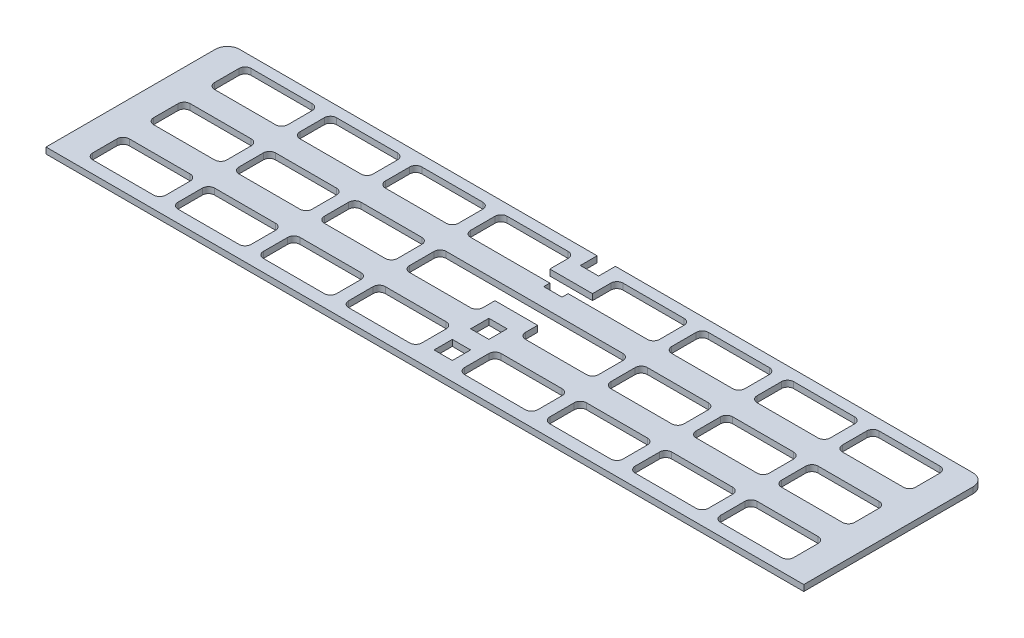
from build123d import *

# Parameters (mm, degrees)
BOSS_EXTRUDE1_DEPTH = 6.35
CUT_EXTRUDE1_DEPTH  = 6.35
SKETCH3_W           = 19.05
SKETCH3_H           = 19.05
BOSS_EXTRUDE2_DEPTH = 6.35
CUT_EXTRUDE2_DEPTH  = 447.276861552


with BuildPart() as part:
    # Sketch1 → Boss-Extrude1 (new body)
    with BuildSketch(Plane(origin=(0, 0, 0), x_dir=(1, 0, 0), z_dir=(0, 1, 0))):
        with BuildLine():
            Line((0, 0), (385.191, 0))
            Line((385.191, 0), (385.191, 176.276))
            ThreePointArc((385.191, 176.276), (381.471256121, 185.256256121), (372.491, 188.976))
            Line((372.491, 188.976), (0, 188.976))
            Line((0, 188.976), (0, 0))
        make_face()
    boss_extrude1 = extrude(amount=BOSS_EXTRUDE1_DEPTH)

    # Sketch2 → Cut-Extrude1 (cut)
    with BuildSketch(Plane(origin=(0, 6.35, 0), x_dir=(1, 0, 0), z_dir=(0, 1, 0))):
        with BuildLine():
            Line((279.4, 19.05), (279.4, 44.45))
            ThreePointArc((279.4, 44.45), (281.259871939, 48.940128061), (285.75, 50.8))
            Line((285.75, 50.8), (349.25, 50.8))
            ThreePointArc((349.25, 50.8), (353.740128061, 48.940128061), (355.6, 44.45))
            Line((355.6, 44.45), (355.6, 19.05))
            ThreePointArc((355.6, 19.05), (353.740128061, 14.559871939), (349.25, 12.7))
            Line((349.25, 12.7), (285.75, 12.7))
            ThreePointArc((285.75, 12.7), (281.259871939, 14.559871939), (279.4, 19.05))
        make_face()
        with BuildLine():
            Line((279.4, 82.55), (279.4, 107.95))
            ThreePointArc((279.4, 107.95), (281.259871939, 112.440128061), (285.75, 114.3))
            Line((285.75, 114.3), (349.25, 114.3))
            ThreePointArc((349.25, 114.3), (353.740128061, 112.440128061), (355.6, 107.95))
            Line((355.6, 107.95), (355.6, 82.55))
            ThreePointArc((355.6, 82.55), (353.740128061, 78.059871939), (349.25, 76.2))
            Line((349.25, 76.2), (285.75, 76.2))
            ThreePointArc((285.75, 76.2), (281.259871939, 78.059871939), (279.4, 82.55))
        make_face()
        with BuildLine():
            Line((101.6, 19.05), (101.6, 44.45))
            ThreePointArc((101.6, 44.45), (103.459871939, 48.940128061), (107.95, 50.8))
            Line((107.95, 50.8), (171.45, 50.8))
            ThreePointArc((171.45, 50.8), (175.940128061, 48.940128061), (177.8, 44.45))
            Line((177.8, 44.45), (177.8, 19.05))
            ThreePointArc((177.8, 19.05), (175.940128061, 14.559871939), (171.45, 12.7))
            Line((171.45, 12.7), (107.95, 12.7))
            ThreePointArc((107.95, 12.7), (103.459871939, 14.559871939), (101.6, 19.05))
        make_face()
        with BuildLine():
            Line((279.4, 146.05), (279.4, 171.45))
            ThreePointArc((279.4, 171.45), (281.259871939, 175.940128061), (285.75, 177.8))
            Line((285.75, 177.8), (349.25, 177.8))
            ThreePointArc((349.25, 177.8), (353.740128061, 175.940128061), (355.6, 171.45))
            Line((355.6, 171.45), (355.6, 146.05))
            ThreePointArc((355.6, 146.05), (353.740128061, 141.559871939), (349.25, 139.7))
            Line((349.25, 139.7), (285.75, 139.7))
            ThreePointArc((285.75, 139.7), (281.259871939, 141.559871939), (279.4, 146.05))
        make_face()
        with BuildLine():
            Line((19.05, 12.7), (82.55, 12.7))
            ThreePointArc((82.55, 12.7), (87.040128061, 14.559871939), (88.9, 19.05))
            Line((88.9, 19.05), (88.9, 44.45))
            ThreePointArc((88.9, 44.45), (87.040128061, 48.940128061), (82.55, 50.8))
            Line((82.55, 50.8), (19.05, 50.8))
            ThreePointArc((19.05, 50.8), (14.559871939, 48.940128061), (12.7, 44.45))
            Line((12.7, 44.45), (12.7, 19.05))
            ThreePointArc((12.7, 19.05), (14.559871939, 14.559871939), (19.05, 12.7))
        make_face()
        with BuildLine():
            Line((190.5, 19.05), (190.5, 44.45))
            ThreePointArc((190.5, 44.45), (192.359871939, 48.940128061), (196.85, 50.8))
            Line((196.85, 50.8), (260.35, 50.8))
            ThreePointArc((260.35, 50.8), (264.840128061, 48.940128061), (266.7, 44.45))
            Line((266.7, 44.45), (266.7, 19.05))
            ThreePointArc((266.7, 19.05), (264.840128061, 14.559871939), (260.35, 12.7))
            Line((260.35, 12.7), (196.85, 12.7))
            ThreePointArc((196.85, 12.7), (192.359871939, 14.559871939), (190.5, 19.05))
        make_face()
        with BuildLine():
            Line((101.6, 82.55), (101.6, 107.95))
            ThreePointArc((101.6, 107.95), (103.459871939, 112.440128061), (107.95, 114.3))
            Line((107.95, 114.3), (171.45, 114.3))
            ThreePointArc((171.45, 114.3), (175.940128061, 112.440128061), (177.8, 107.95))
            Line((177.8, 107.95), (177.8, 82.55))
            ThreePointArc((177.8, 82.55), (175.940128061, 78.059871939), (171.45, 76.2))
            Line((171.45, 76.2), (107.95, 76.2))
            ThreePointArc((107.95, 76.2), (103.459871939, 78.059871939), (101.6, 82.55))
        make_face()
        with BuildLine():
            Line((190.5, 82.55), (190.5, 107.95))
            ThreePointArc((190.5, 107.95), (192.359871939, 112.440128061), (196.85, 114.3))
            Line((196.85, 114.3), (260.35, 114.3))
            ThreePointArc((260.35, 114.3), (264.840128061, 112.440128061), (266.7, 107.95))
            Line((266.7, 107.95), (266.7, 82.55))
            ThreePointArc((266.7, 82.55), (264.840128061, 78.059871939), (260.35, 76.2))
            Line((260.35, 76.2), (196.85, 76.2))
            ThreePointArc((196.85, 76.2), (192.359871939, 78.059871939), (190.5, 82.55))
        make_face()
        with BuildLine():
            Line((101.6, 146.05), (101.6, 171.45))
            ThreePointArc((101.6, 171.45), (103.459871939, 175.940128061), (107.95, 177.8))
            Line((107.95, 177.8), (171.45, 177.8))
            ThreePointArc((171.45, 177.8), (175.940128061, 175.940128061), (177.8, 171.45))
            Line((177.8, 171.45), (177.8, 146.05))
            ThreePointArc((177.8, 146.05), (175.940128061, 141.559871939), (171.45, 139.7))
            Line((171.45, 139.7), (107.95, 139.7))
            ThreePointArc((107.95, 139.7), (103.459871939, 141.559871939), (101.6, 146.05))
        make_face()
        with BuildLine():
            Line((190.5, 146.05), (190.5, 171.45))
            ThreePointArc((190.5, 171.45), (192.359871939, 175.940128061), (196.85, 177.8))
            Line((196.85, 177.8), (260.35, 177.8))
            ThreePointArc((260.35, 177.8), (264.840128061, 175.940128061), (266.7, 171.45))
            Line((266.7, 171.45), (266.7, 146.05))
            ThreePointArc((266.7, 146.05), (264.840128061, 141.559871939), (260.35, 139.7))
            Line((260.35, 139.7), (196.85, 139.7))
            ThreePointArc((196.85, 139.7), (192.359871939, 141.559871939), (190.5, 146.05))
        make_face()
        with BuildLine():
            Line((12.7, 82.55), (12.7, 107.95))
            ThreePointArc((12.7, 107.95), (14.559871939, 112.440128061), (19.05, 114.3))
            Line((19.05, 114.3), (82.55, 114.3))
            ThreePointArc((82.55, 114.3), (87.040128061, 112.440128061), (88.9, 107.95))
            Line((88.9, 107.95), (88.9, 82.55))
            ThreePointArc((88.9, 82.55), (87.040128061, 78.059871939), (82.55, 76.2))
            Line((82.55, 76.2), (19.05, 76.2))
            ThreePointArc((19.05, 76.2), (14.559871939, 78.059871939), (12.7, 82.55))
        make_face()
        with BuildLine():
            Line((12.7, 146.05), (12.7, 171.45))
            ThreePointArc((12.7, 171.45), (14.559871939, 175.940128061), (19.05, 177.8))
            Line((19.05, 177.8), (82.55, 177.8))
            ThreePointArc((82.55, 177.8), (87.040128061, 175.940128061), (88.9, 171.45))
            Line((88.9, 171.45), (88.9, 146.05))
            ThreePointArc((88.9, 146.05), (87.040128061, 141.559871939), (82.55, 139.7))
            Line((82.55, 139.7), (19.05, 139.7))
            ThreePointArc((19.05, 139.7), (14.559871939, 141.559871939), (12.7, 146.05))
        make_face()
    cut_extrude1 = extrude(amount=-CUT_EXTRUDE1_DEPTH, mode=Mode.SUBTRACT)

    # Sketch3 → Boss-Extrude2 (add)
    with BuildSketch(Plane(origin=(0, 6.35, 0), x_dir=(1, 0, 0), z_dir=(0, 1, 0))):
        with Locations((-9.525, 9.525)):
            Rectangle(SKETCH3_W, SKETCH3_H)
        with Locations((-9.525, 47.625)):
            Rectangle(SKETCH3_W, SKETCH3_H)
        with Locations((-9.525, 85.725)):
            Rectangle(SKETCH3_W, SKETCH3_H)
        with Locations((-9.525, 123.825)):
            Rectangle(SKETCH3_W, SKETCH3_H)
        with Locations((-9.525, 161.925)):
            Rectangle(SKETCH3_W, SKETCH3_H)
    extrude(amount=-BOSS_EXTRUDE2_DEPTH)

    # Mirror3: Boss-Extrude1 across plane
    add(boss_extrude1.mirror(Plane.ZY.offset(9.525)))

    # Mirror2: Cut-Extrude1 across plane
    add(cut_extrude1.mirror(Plane.ZY.offset(9.525)), mode=Mode.SUBTRACT)

    # Sketch4 → Cut-Extrude2 (cut, through all)
    with BuildSketch(Plane(origin=(0, 6.35, 0), x_dir=(1, 0, 0), z_dir=(0, 1, 0))):
        Polygon((-19.05, 152.4), (-31.75, 152.4), (-38.1, 139.7), (-19.05, 139.7), align=None)
        Polygon((0, 152.4), (12.7, 152.4), (19.05, 139.7), (0, 139.7), align=None)
        Polygon((-19.05, 95.25), (-31.75, 95.25), (-38.1, 114.3), (-19.05, 114.3), align=None)
        Polygon((0, 114.3), (19.05, 114.3), (12.7, 95.25), (0, 95.25), align=None)
    extrude(amount=-CUT_EXTRUDE2_DEPTH, mode=Mode.SUBTRACT)


solid = part.part
